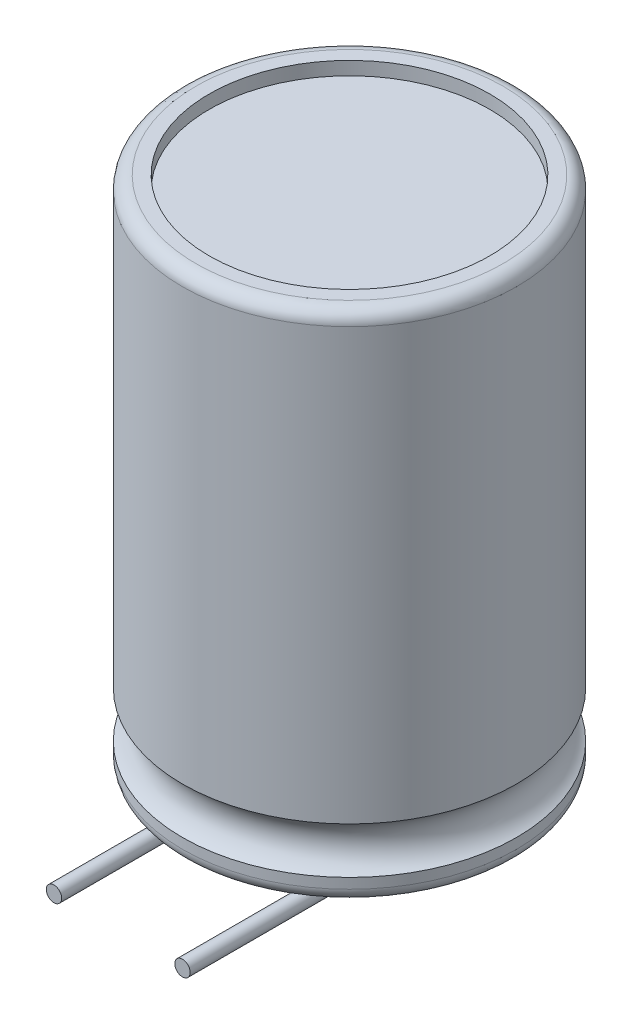
from build123d import *

# Parameters (mm, degrees)
SKETCH16_R = 0.3


with BuildPart() as part:
    # Sketch1 → Body (revolve)
    with BuildSketch(Plane.XY, mode=Mode.PRIVATE) as body_sk:
        with BuildLine():
            Line((6.5, 2.72066642), (6.5, 19.48))
            ThreePointArc((6.5, 19.48), (6.347695526, 19.847695526), (5.98, 20))
            Line((5.98, 20), (5.46, 20))
            Line((5.46, 20), (5.46, 19.48))
            Line((5.46, 19.48), (0, 19.48))
            Line((0, 19.48), (0, 0.52))
            Line((0, 0.52), (5.46, 0.52))
            Line((5.46, 0.52), (5.46, 0))
            Line((5.46, 0), (5.98, 0))
            ThreePointArc((5.98, 0), (6.347695526, 0.152304474), (6.5, 0.52))
            Line((6.5, 0.52), (6.5, 0.91933358))
            ThreePointArc((6.5, 0.91933358), (5.98, 1.82), (6.5, 2.72066642))
        make_face()
    revolve(body_sk.sketch.rotate(Axis((0, 0.52, 0), (0, 1, 0)), 90), axis=Axis((0, 0.52, 0), (0, 1, 0)))

    # По траектории1: sweep along a path in Эскиз1
    with BuildLine(Plane(origin=(0, 0, 0), x_dir=(0, 0, -1), z_dir=(1, 0, 0))) as sweep_1_path:
        Line((0, 0.52), (0, 0.02))
        ThreePointArc((0, 0.02), (-0.292893219, -0.687106781), (-1, -0.98))
        Line((-1, -0.98), (-9, -0.98))
    # Sketch16 → По траектории1 (sweep)
    with BuildSketch(Plane(origin=(0, 0.52, 0), x_dir=(1, 0, 0), z_dir=(0, 1, 0))):
        with Locations((-2.5, 0)):
            Circle(SKETCH16_R)
        with Locations((2.5, 0)):
            Circle(SKETCH16_R)
    sweep(path=sweep_1_path.line)


solid = part.part
